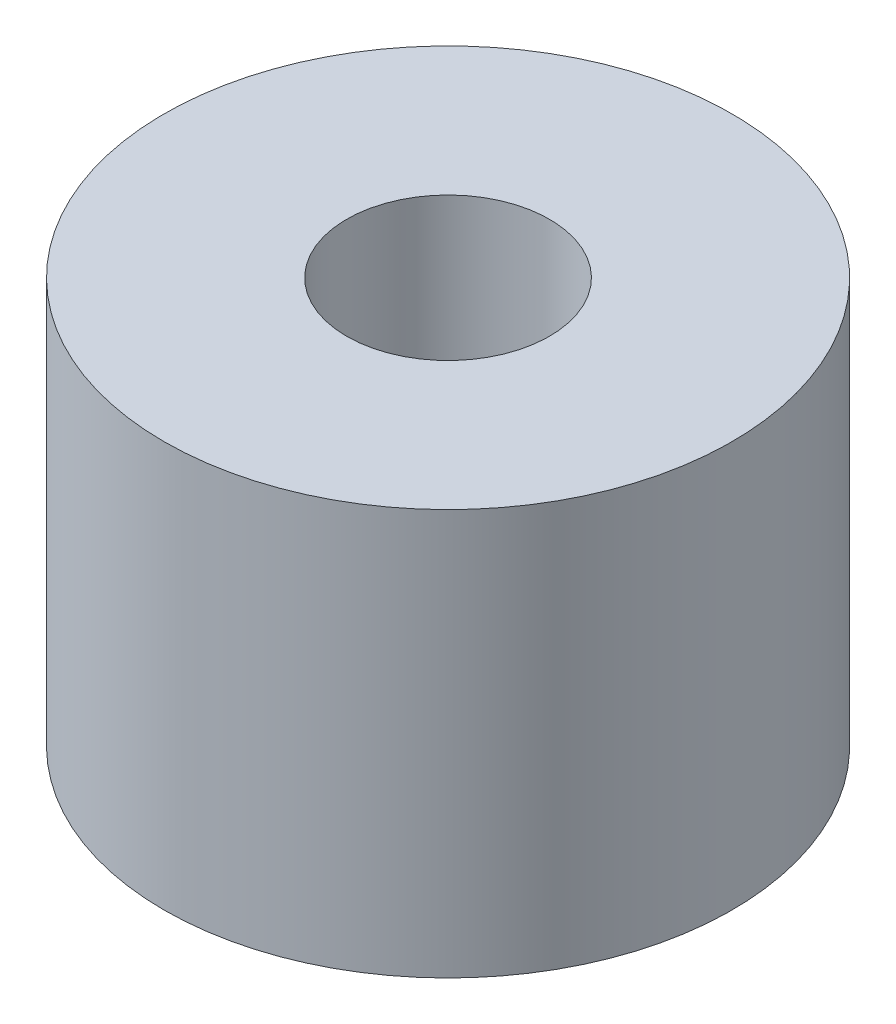
from build123d import *

# Parameters (mm, degrees)
ESQUISSE1_R        = 14
ESQUISSE1_R_2      = 5
BOSS_EXTRU_1_DEPTH = 20


with BuildPart() as part:
    # Esquisse1 → Boss.-Extru.1 (new body)
    with BuildSketch(Plane(origin=(0, 0, 0), x_dir=(1, 0, 0), z_dir=(0, 1, 0))):
        with Locations(Location((0, 0, 0), (0, 0, 270))):
            Circle(ESQUISSE1_R)
        with Locations(Location((0, 0, 0), (0, 0, 270))):
            Circle(ESQUISSE1_R_2, mode=Mode.SUBTRACT)
    extrude(amount=BOSS_EXTRU_1_DEPTH)


solid = part.part
